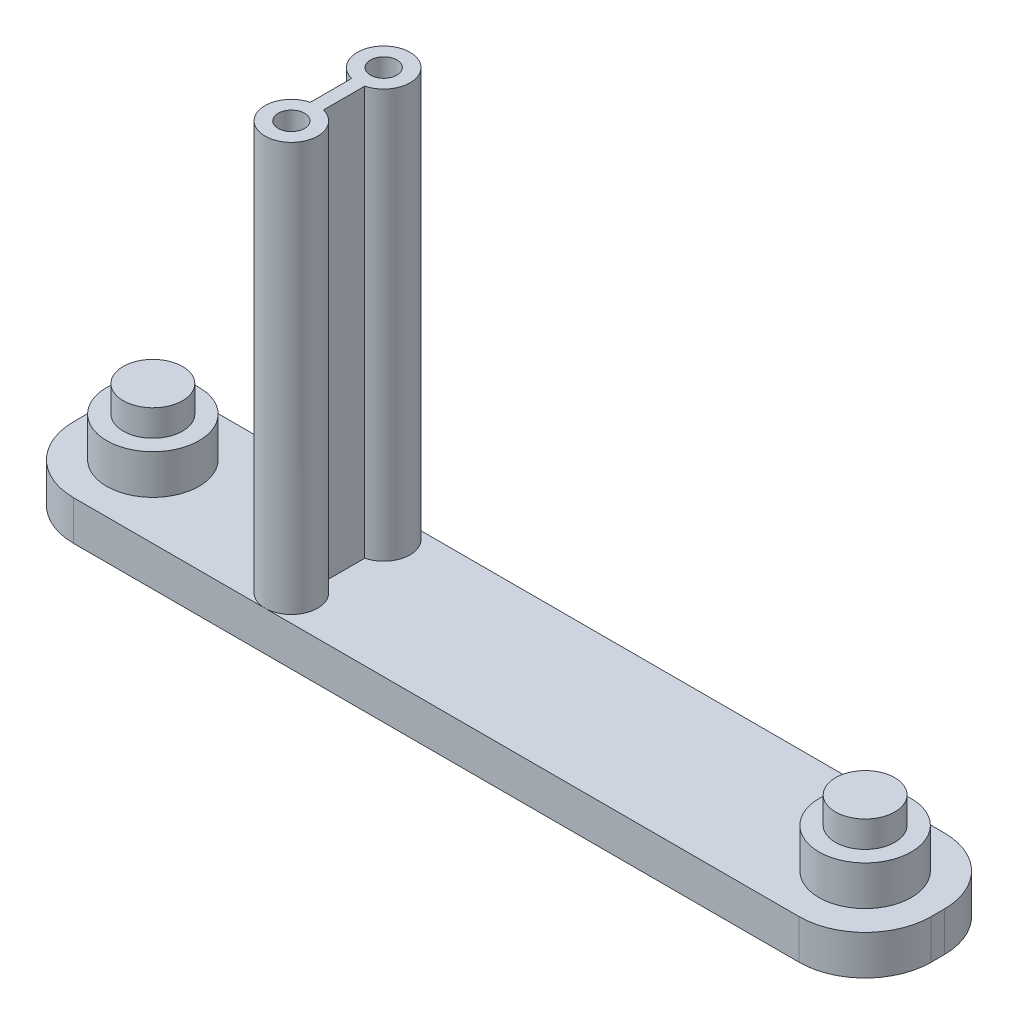
from build123d import *

# Parameters (mm, degrees)
SKETCH2_W           = 65
SKETCH2_H           = 11
BOSS_EXTRUDE1_DEPTH = 3
SKETCH2_4_R         = 3.5
SKETCH2_4_R_2       = 2.25
BOSS_EXTRUDE2_DEPTH = 3
SKETCH2_5_R         = 2.25
BOSS_EXTRUDE3_DEPTH = 5
SKETCH2_6_R         = 2
BOSS_EXTRUDE4_DEPTH = 31
FILLET1_R           = 5
SKETCH3_R           = 1
CUT_EXTRUDE1_DEPTH  = 10


with BuildPart() as part:
    # Sketch2 → Boss-Extrude1 (new body)
    with BuildSketch(Plane(origin=(0, 0, 0), x_dir=(1, 0, 0), z_dir=(0, 1, 0))):
        with Locations((-23.91453319, 13.570918432)):
            Rectangle(SKETCH2_W, SKETCH2_H)
    extrude(amount=-BOSS_EXTRUDE1_DEPTH)

    # Sketch2<4> → Boss-Extrude2 (add)
    with BuildSketch(Plane(origin=(0, 0, 0), x_dir=(1, 0, 0), z_dir=(0, 1, 0))):
        with Locations(Location((-50.91453319, 13.570918432, 0), (0, 0, 270))):
            Circle(SKETCH2_4_R)
        with Locations(Location((3.08546681, 13.570918432, 0), (0, 0, 270))):
            Circle(SKETCH2_4_R)
        with Locations((-50.91453319, 13.570918432)):
            Circle(SKETCH2_4_R_2)
        with Locations((3.08546681, 13.570918432)):
            Circle(SKETCH2_4_R_2)
    extrude(amount=BOSS_EXTRUDE2_DEPTH)

    # Sketch2<5> → Boss-Extrude3 (add)
    with BuildSketch(Plane(origin=(0, 0, 0), x_dir=(1, 0, 0), z_dir=(0, 1, 0))):
        with Locations(Location((-50.91453319, 13.570918432, 0), (0, 0, 270))):
            Circle(SKETCH2_5_R)
        with Locations(Location((3.08546681, 13.570918432, 0), (0, 0, 270))):
            Circle(SKETCH2_5_R)
    extrude(amount=BOSS_EXTRUDE3_DEPTH)

    # Sketch2<6> → Boss-Extrude4 (add)
    with BuildSketch(Plane(origin=(0, 0, 0), x_dir=(1, 0, 0), z_dir=(0, 1, 0))):
        with Locations((-36.91453319, 17.070918432)):
            Circle(SKETCH2_6_R)
        with Locations((-36.91453319, 10.070918432)):
            Circle(SKETCH2_6_R)
        with BuildLine():
            ThreePointArc((-36.41453319, 15.134426759), (-36.91453319, 15.070918432), (-37.41453319, 15.134426759))
            Line((-37.41453319, 15.134426759), (-37.41453319, 12.007410105))
            ThreePointArc((-37.41453319, 12.007410105), (-36.91453319, 12.070918432), (-36.41453319, 12.007410105))
            Line((-36.41453319, 12.007410105), (-36.41453319, 15.134426759))
        make_face()
    extrude(amount=BOSS_EXTRUDE4_DEPTH)

    # Fillet1
    fillet1_edges = [part.edges().sort_by_distance(p)[0] for p in [
        (-56.41453319, -1.5, -8.070918432),
        (-56.41453319, -1.5, -19.070918432),
        (8.58546681, -1.5, -19.070918432),
        (8.58546681, -1.5, -8.070918432),
    ]]
    fillet(fillet1_edges, radius=FILLET1_R)

    # Sketch3 → Cut-Extrude1 (cut)
    with BuildSketch(Plane(origin=(0, 31, 0), x_dir=(1, 0, 0), z_dir=(0, 1, 0))):
        with Locations(Location((-36.91453319, 10.070918432, 0), (0, 0, 270))):
            Circle(SKETCH3_R)
        with Locations(Location((-36.91453319, 17.070918432, 0), (0, 0, 270))):
            Circle(SKETCH3_R)
    extrude(amount=-CUT_EXTRUDE1_DEPTH, mode=Mode.SUBTRACT)


solid = part.part
